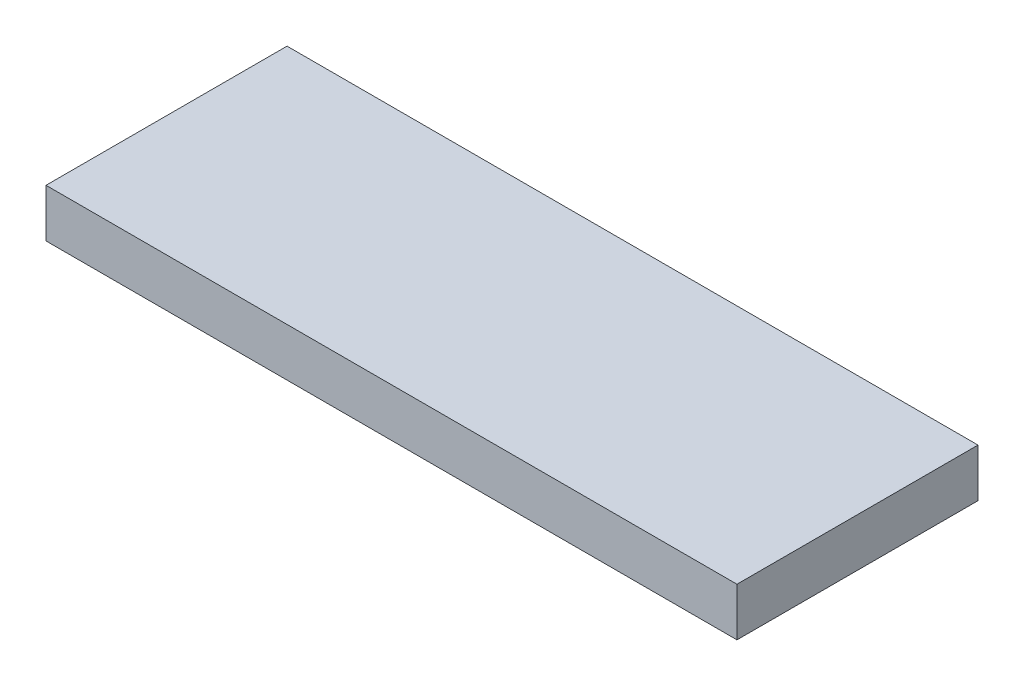
from build123d import *

# Parameters (mm, degrees)
ESBO_O1_W                = 43
ESBO_O1_H                = 15
RESSALTO_EXTRUS_O1_DEPTH = 1.5


with BuildPart() as part:
    # Esboço1 → Ressalto-extrusão1 (new, symmetric)
    with BuildSketch(Plane(origin=(0, 0, 0), x_dir=(1, 0, 0), z_dir=(0, 1, 0))):
        Rectangle(ESBO_O1_W, ESBO_O1_H)
    extrude(amount=RESSALTO_EXTRUS_O1_DEPTH, both=True)


solid = part.part
